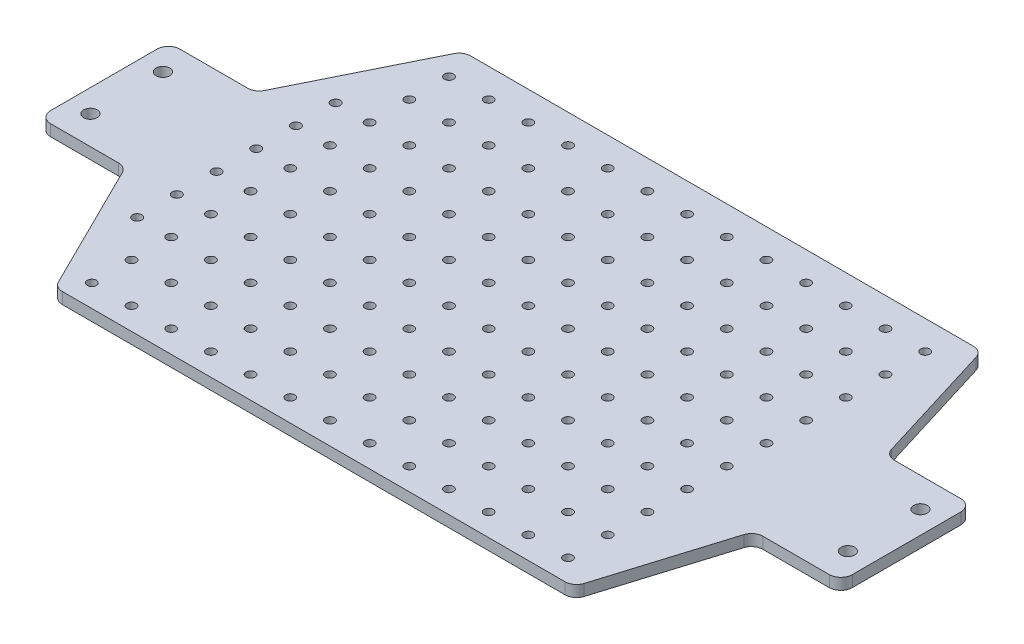
from build123d import *

# Parameters (mm, degrees)
BOSS_EXTRUDE1_DEPTH = 5
SKETCH2_R           = 3
CUT_EXTRUDE1_DEPTH  = 5
SKETCH3_R           = 2
CUT_EXTRUDE4_DEPTH  = 5
FILLET1_R           = 5.08
SKETCH4_R           = 2.032
CUT_EXTRUDE5_DEPTH  = 5


with BuildPart() as part:
    # Sketch1 → Boss-Extrude1 (new body)
    with BuildSketch(Plane(origin=(0, 0, 0), x_dir=(1, 0, 0), z_dir=(0, 1, 0))):
        Polygon((-217.106521109, 10.433223157), (-217.106521109, -46.566776843), (-179.006521109, -46.566776843), (-148.552941291, -108.066776843), (80.047058709, -108.066776843), (98.793478891, -47.066776843), (136.893478891, -47.066776843), (136.893478891, 10.933223157), (98.793478891, 10.933223157), (80.047058709, 71.933223157), (-148.552941291, 71.933223157), (-179.006521109, 10.433223157), align=None)
    extrude(amount=BOSS_EXTRUDE1_DEPTH)

    # Sketch2 → Cut-Extrude1 (cut)
    with BuildSketch(Plane(origin=(0, 5, 0), x_dir=(1, 0, 0), z_dir=(0, 1, 0))):
        with Locations(Location((-207.106521109, -2.012776843, 0), (0, 0, 270))):
            Circle(SKETCH2_R)
        with Locations(Location((-207.106521109, -34.012776843, 0), (0, 0, 270))):
            Circle(SKETCH2_R)
        with Locations(Location((126.969478891, -34.012776843, 0), (0, 0, 90))):
            Circle(SKETCH2_R)
        with Locations(Location((126.969478891, -2.012776843, 0), (0, 0, 90))):
            Circle(SKETCH2_R)
    extrude(amount=-CUT_EXTRUDE1_DEPTH, mode=Mode.SUBTRACT)

    # Sketch3 → Cut-Extrude4 (cut)
    with BuildSketch(Plane(origin=(0, 5, 0), x_dir=(1, 0, 0), z_dir=(0, 1, 0))):
        with Locations(Location((-142.202941291, 59.233223157, 0), (0, 0, 270))):
            Circle(SKETCH3_R)
        with Locations(Location((-124.702941239, 59.233223157, 0), (0, 0, 270))):
            Circle(SKETCH3_R)
        with Locations(Location((-107.202941187, 59.233223157, 0), (0, 0, 270))):
            Circle(SKETCH3_R)
        with Locations(Location((-89.702941135, 59.233223157, 0), (0, 0, 270))):
            Circle(SKETCH3_R)
        with Locations(Location((-72.202941083, 59.233223157, 0), (0, 0, 270))):
            Circle(SKETCH3_R)
        with Locations(Location((-54.702941031, 59.233223157, 0), (0, 0, 270))):
            Circle(SKETCH3_R)
        with Locations(Location((-37.202940979, 59.233223157, 0), (0, 0, 270))):
            Circle(SKETCH3_R)
        with Locations(Location((-19.702940927, 59.233223157, 0), (0, 0, 270))):
            Circle(SKETCH3_R)
        with Locations(Location((-2.202940875, 59.233223157, 0), (0, 0, 270))):
            Circle(SKETCH3_R)
        with Locations(Location((15.297059177, 59.233223157, 0), (0, 0, 270))):
            Circle(SKETCH3_R)
        with Locations(Location((32.797059229, 59.233223157, 0), (0, 0, 270))):
            Circle(SKETCH3_R)
        with Locations(Location((50.297059281, 59.233223157, 0), (0, 0, 270))):
            Circle(SKETCH3_R)
        with Locations(Location((67.797059333, 59.233223157, 0), (0, 0, 270))):
            Circle(SKETCH3_R)
        with Locations(Location((-124.702941239, 41.733223105, 0), (0, 0, 270))):
            Circle(SKETCH3_R)
        with Locations(Location((-107.202941187, 41.733223105, 0), (0, 0, 270))):
            Circle(SKETCH3_R)
        with Locations(Location((-89.702941135, 41.733223105, 0), (0, 0, 270))):
            Circle(SKETCH3_R)
        with Locations(Location((-72.202941083, 41.733223105, 0), (0, 0, 270))):
            Circle(SKETCH3_R)
        with Locations(Location((-54.702941031, 41.733223105, 0), (0, 0, 270))):
            Circle(SKETCH3_R)
        with Locations(Location((-37.202940979, 41.733223105, 0), (0, 0, 270))):
            Circle(SKETCH3_R)
        with Locations(Location((-19.702940927, 41.733223105, 0), (0, 0, 270))):
            Circle(SKETCH3_R)
        with Locations(Location((-2.202940875, 41.733223105, 0), (0, 0, 270))):
            Circle(SKETCH3_R)
        with Locations(Location((15.297059177, 41.733223105, 0), (0, 0, 270))):
            Circle(SKETCH3_R)
        with Locations(Location((32.797059229, 41.733223105, 0), (0, 0, 270))):
            Circle(SKETCH3_R)
        with Locations(Location((50.297059281, 41.733223105, 0), (0, 0, 270))):
            Circle(SKETCH3_R)
        with Locations(Location((67.797059333, 41.733223105, 0), (0, 0, 270))):
            Circle(SKETCH3_R)
        with Locations(Location((-124.702941239, 24.233223053, 0), (0, 0, 270))):
            Circle(SKETCH3_R)
        with Locations(Location((-107.202941187, 24.233223053, 0), (0, 0, 270))):
            Circle(SKETCH3_R)
        with Locations(Location((-89.702941135, 24.233223053, 0), (0, 0, 270))):
            Circle(SKETCH3_R)
        with Locations(Location((-72.202941083, 24.233223053, 0), (0, 0, 270))):
            Circle(SKETCH3_R)
        with Locations(Location((-54.702941031, 24.233223053, 0), (0, 0, 270))):
            Circle(SKETCH3_R)
        with Locations(Location((-37.202940979, 24.233223053, 0), (0, 0, 270))):
            Circle(SKETCH3_R)
        with Locations(Location((-19.702940927, 24.233223053, 0), (0, 0, 270))):
            Circle(SKETCH3_R)
        with Locations(Location((-2.202940875, 24.233223053, 0), (0, 0, 270))):
            Circle(SKETCH3_R)
        with Locations(Location((15.297059177, 24.233223053, 0), (0, 0, 270))):
            Circle(SKETCH3_R)
        with Locations(Location((32.797059229, 24.233223053, 0), (0, 0, 270))):
            Circle(SKETCH3_R)
        with Locations(Location((50.297059281, 24.233223053, 0), (0, 0, 270))):
            Circle(SKETCH3_R)
        with Locations(Location((67.797059333, 24.233223053, 0), (0, 0, 270))):
            Circle(SKETCH3_R)
        with Locations(Location((-124.702941239, 6.733223001, 0), (0, 0, 270))):
            Circle(SKETCH3_R)
        with Locations(Location((-107.202941187, 6.733223001, 0), (0, 0, 270))):
            Circle(SKETCH3_R)
        with Locations(Location((-89.702941135, 6.733223001, 0), (0, 0, 270))):
            Circle(SKETCH3_R)
        with Locations(Location((-72.202941083, 6.733223001, 0), (0, 0, 270))):
            Circle(SKETCH3_R)
        with Locations(Location((-54.702941031, 6.733223001, 0), (0, 0, 270))):
            Circle(SKETCH3_R)
        with Locations(Location((-37.202940979, 6.733223001, 0), (0, 0, 270))):
            Circle(SKETCH3_R)
        with Locations(Location((-19.702940927, 6.733223001, 0), (0, 0, 270))):
            Circle(SKETCH3_R)
        with Locations(Location((-2.202940875, 6.733223001, 0), (0, 0, 270))):
            Circle(SKETCH3_R)
        with Locations(Location((15.297059177, 6.733223001, 0), (0, 0, 270))):
            Circle(SKETCH3_R)
        with Locations(Location((32.797059229, 6.733223001, 0), (0, 0, 270))):
            Circle(SKETCH3_R)
        with Locations(Location((50.297059281, 6.733223001, 0), (0, 0, 270))):
            Circle(SKETCH3_R)
        with Locations(Location((67.797059333, 6.733223001, 0), (0, 0, 270))):
            Circle(SKETCH3_R)
        with Locations(Location((-124.702941239, -10.766777051, 0), (0, 0, 270))):
            Circle(SKETCH3_R)
        with Locations(Location((-107.202941187, -10.766777051, 0), (0, 0, 270))):
            Circle(SKETCH3_R)
        with Locations(Location((-89.702941135, -10.766777051, 0), (0, 0, 270))):
            Circle(SKETCH3_R)
        with Locations(Location((-72.202941083, -10.766777051, 0), (0, 0, 270))):
            Circle(SKETCH3_R)
        with Locations(Location((-54.702941031, -10.766777051, 0), (0, 0, 270))):
            Circle(SKETCH3_R)
        with Locations(Location((-37.202940979, -10.766777051, 0), (0, 0, 270))):
            Circle(SKETCH3_R)
        with Locations(Location((-19.702940927, -10.766777051, 0), (0, 0, 270))):
            Circle(SKETCH3_R)
        with Locations(Location((-2.202940875, -10.766777051, 0), (0, 0, 270))):
            Circle(SKETCH3_R)
        with Locations(Location((15.297059177, -10.766777051, 0), (0, 0, 270))):
            Circle(SKETCH3_R)
        with Locations(Location((32.797059229, -10.766777051, 0), (0, 0, 270))):
            Circle(SKETCH3_R)
        with Locations(Location((50.297059281, -10.766777051, 0), (0, 0, 270))):
            Circle(SKETCH3_R)
        with Locations(Location((67.797059333, -10.766777051, 0), (0, 0, 270))):
            Circle(SKETCH3_R)
        with Locations(Location((-124.702941239, -28.266777103, 0), (0, 0, 270))):
            Circle(SKETCH3_R)
        with Locations(Location((-107.202941187, -28.266777103, 0), (0, 0, 270))):
            Circle(SKETCH3_R)
        with Locations(Location((-89.702941135, -28.266777103, 0), (0, 0, 270))):
            Circle(SKETCH3_R)
        with Locations(Location((-72.202941083, -28.266777103, 0), (0, 0, 270))):
            Circle(SKETCH3_R)
        with Locations(Location((-54.702941031, -28.266777103, 0), (0, 0, 270))):
            Circle(SKETCH3_R)
        with Locations(Location((-37.202940979, -28.266777103, 0), (0, 0, 270))):
            Circle(SKETCH3_R)
        with Locations(Location((-19.702940927, -28.266777103, 0), (0, 0, 270))):
            Circle(SKETCH3_R)
        with Locations(Location((-2.202940875, -28.266777103, 0), (0, 0, 270))):
            Circle(SKETCH3_R)
        with Locations(Location((15.297059177, -28.266777103, 0), (0, 0, 270))):
            Circle(SKETCH3_R)
        with Locations(Location((32.797059229, -28.266777103, 0), (0, 0, 270))):
            Circle(SKETCH3_R)
        with Locations(Location((50.297059281, -28.266777103, 0), (0, 0, 270))):
            Circle(SKETCH3_R)
        with Locations(Location((67.797059333, -28.266777103, 0), (0, 0, 270))):
            Circle(SKETCH3_R)
        with Locations(Location((-124.702941239, -45.766777155, 0), (0, 0, 270))):
            Circle(SKETCH3_R)
        with Locations(Location((-107.202941187, -45.766777155, 0), (0, 0, 270))):
            Circle(SKETCH3_R)
        with Locations(Location((-89.702941135, -45.766777155, 0), (0, 0, 270))):
            Circle(SKETCH3_R)
        with Locations(Location((-72.202941083, -45.766777155, 0), (0, 0, 270))):
            Circle(SKETCH3_R)
        with Locations(Location((-54.702941031, -45.766777155, 0), (0, 0, 270))):
            Circle(SKETCH3_R)
        with Locations(Location((-37.202940979, -45.766777155, 0), (0, 0, 270))):
            Circle(SKETCH3_R)
        with Locations(Location((-19.702940927, -45.766777155, 0), (0, 0, 270))):
            Circle(SKETCH3_R)
        with Locations(Location((-2.202940875, -45.766777155, 0), (0, 0, 270))):
            Circle(SKETCH3_R)
        with Locations(Location((15.297059177, -45.766777155, 0), (0, 0, 270))):
            Circle(SKETCH3_R)
        with Locations(Location((32.797059229, -45.766777155, 0), (0, 0, 270))):
            Circle(SKETCH3_R)
        with Locations(Location((50.297059281, -45.766777155, 0), (0, 0, 270))):
            Circle(SKETCH3_R)
        with Locations(Location((67.797059333, -45.766777155, 0), (0, 0, 270))):
            Circle(SKETCH3_R)
        with Locations(Location((-124.702941239, -63.266777207, 0), (0, 0, 270))):
            Circle(SKETCH3_R)
        with Locations(Location((-107.202941187, -63.266777207, 0), (0, 0, 270))):
            Circle(SKETCH3_R)
        with Locations(Location((-89.702941135, -63.266777207, 0), (0, 0, 270))):
            Circle(SKETCH3_R)
        with Locations(Location((-72.202941083, -63.266777207, 0), (0, 0, 270))):
            Circle(SKETCH3_R)
        with Locations(Location((-54.702941031, -63.266777207, 0), (0, 0, 270))):
            Circle(SKETCH3_R)
        with Locations(Location((-37.202940979, -63.266777207, 0), (0, 0, 270))):
            Circle(SKETCH3_R)
        with Locations(Location((-19.702940927, -63.266777207, 0), (0, 0, 270))):
            Circle(SKETCH3_R)
        with Locations(Location((-2.202940875, -63.266777207, 0), (0, 0, 270))):
            Circle(SKETCH3_R)
        with Locations(Location((15.297059177, -63.266777207, 0), (0, 0, 270))):
            Circle(SKETCH3_R)
        with Locations(Location((32.797059229, -63.266777207, 0), (0, 0, 270))):
            Circle(SKETCH3_R)
        with Locations(Location((50.297059281, -63.266777207, 0), (0, 0, 270))):
            Circle(SKETCH3_R)
        with Locations(Location((67.797059333, -63.266777207, 0), (0, 0, 270))):
            Circle(SKETCH3_R)
        with Locations(Location((-124.702941239, -80.766777259, 0), (0, 0, 270))):
            Circle(SKETCH3_R)
        with Locations(Location((-107.202941187, -80.766777259, 0), (0, 0, 270))):
            Circle(SKETCH3_R)
        with Locations(Location((-89.702941135, -80.766777259, 0), (0, 0, 270))):
            Circle(SKETCH3_R)
        with Locations(Location((-72.202941083, -80.766777259, 0), (0, 0, 270))):
            Circle(SKETCH3_R)
        with Locations(Location((-54.702941031, -80.766777259, 0), (0, 0, 270))):
            Circle(SKETCH3_R)
        with Locations(Location((-37.202940979, -80.766777259, 0), (0, 0, 270))):
            Circle(SKETCH3_R)
        with Locations(Location((-19.702940927, -80.766777259, 0), (0, 0, 270))):
            Circle(SKETCH3_R)
        with Locations(Location((-2.202940875, -80.766777259, 0), (0, 0, 270))):
            Circle(SKETCH3_R)
        with Locations(Location((15.297059177, -80.766777259, 0), (0, 0, 270))):
            Circle(SKETCH3_R)
        with Locations(Location((32.797059229, -80.766777259, 0), (0, 0, 270))):
            Circle(SKETCH3_R)
        with Locations(Location((50.297059281, -80.766777259, 0), (0, 0, 270))):
            Circle(SKETCH3_R)
        with Locations(Location((67.797059333, -80.766777259, 0), (0, 0, 270))):
            Circle(SKETCH3_R)
        with Locations(Location((-124.702941239, -98.266777311, 0), (0, 0, 270))):
            Circle(SKETCH3_R)
        with Locations(Location((-107.202941187, -98.266777311, 0), (0, 0, 270))):
            Circle(SKETCH3_R)
        with Locations(Location((-89.702941135, -98.266777311, 0), (0, 0, 270))):
            Circle(SKETCH3_R)
        with Locations(Location((-72.202941083, -98.266777311, 0), (0, 0, 270))):
            Circle(SKETCH3_R)
        with Locations(Location((-54.702941031, -98.266777311, 0), (0, 0, 270))):
            Circle(SKETCH3_R)
        with Locations(Location((-37.202940979, -98.266777311, 0), (0, 0, 270))):
            Circle(SKETCH3_R)
        with Locations(Location((-19.702940927, -98.266777311, 0), (0, 0, 270))):
            Circle(SKETCH3_R)
        with Locations(Location((-2.202940875, -98.266777311, 0), (0, 0, 270))):
            Circle(SKETCH3_R)
        with Locations(Location((15.297059177, -98.266777311, 0), (0, 0, 270))):
            Circle(SKETCH3_R)
        with Locations(Location((32.797059229, -98.266777311, 0), (0, 0, 270))):
            Circle(SKETCH3_R)
        with Locations(Location((50.297059281, -98.266777311, 0), (0, 0, 270))):
            Circle(SKETCH3_R)
        with Locations(Location((67.797059333, -98.266777311, 0), (0, 0, 270))):
            Circle(SKETCH3_R)
        with Locations(Location((-142.202941291, 41.733223105, 0), (0, 0, 270))):
            Circle(SKETCH3_R)
        with Locations(Location((-142.202941291, 24.233223053, 0), (0, 0, 270))):
            Circle(SKETCH3_R)
        with Locations(Location((-142.202941291, 6.733223001, 0), (0, 0, 270))):
            Circle(SKETCH3_R)
        with Locations(Location((-142.202941291, -10.766777051, 0), (0, 0, 270))):
            Circle(SKETCH3_R)
        with Locations(Location((-142.202941291, -28.266777103, 0), (0, 0, 270))):
            Circle(SKETCH3_R)
        with Locations(Location((-142.202941291, -45.766777155, 0), (0, 0, 270))):
            Circle(SKETCH3_R)
        with Locations(Location((-142.202941291, -63.266777207, 0), (0, 0, 270))):
            Circle(SKETCH3_R)
        with Locations(Location((-142.202941291, -80.766777259, 0), (0, 0, 270))):
            Circle(SKETCH3_R)
        with Locations(Location((-142.202941291, -98.266777311, 0), (0, 0, 270))):
            Circle(SKETCH3_R)
    extrude(amount=-CUT_EXTRUDE4_DEPTH, mode=Mode.SUBTRACT)

    # Fillet1
    fillet1_edges = [part.edges().sort_by_distance(p)[0] for p in [
        (-179.006521109, 2.5, -10.433223157),
        (-148.552941291, 2.5, -71.933223157),
        (80.047058709, 2.5, -71.933223157),
        (98.793478891, 2.5, -10.933223157),
        (136.893478891, 2.5, -10.933223157),
        (136.893478891, 2.5, 47.066776843),
        (98.793478891, 2.5, 47.066776843),
        (80.047058709, 2.5, 108.066776843),
        (-148.552941291, 2.5, 108.066776843),
        (-179.006521109, 2.5, 46.566776843),
        (-217.106521109, 2.5, 46.566776843),
        (-217.106521109, 2.5, -10.433223157),
    ]]
    fillet(fillet1_edges, radius=FILLET1_R)

    # Sketch4 → Cut-Extrude5 (cut)
    with BuildSketch(Plane(origin=(0, 5, 0), x_dir=(1, 0, 0), z_dir=(0, 1, 0))):
        with Locations(Location((-157.202941291, 24.233223053, 0), (0, 0, 270))):
            Circle(SKETCH4_R)
        with Locations(Location((-157.202941291, 6.733223001, 0), (0, 0, 270))):
            Circle(SKETCH4_R)
        with Locations(Location((-157.202941291, -10.766777051, 0), (0, 0, 270))):
            Circle(SKETCH4_R)
        with Locations(Location((-157.202941291, -28.266777103, 0), (0, 0, 270))):
            Circle(SKETCH4_R)
        with Locations(Location((-157.202941291, -45.766777155, 0), (0, 0, 270))):
            Circle(SKETCH4_R)
        with Locations(Location((-157.202941291, -63.266777207, 0), (0, 0, 270))):
            Circle(SKETCH4_R)
    extrude(amount=-CUT_EXTRUDE5_DEPTH, mode=Mode.SUBTRACT)


solid = part.part
